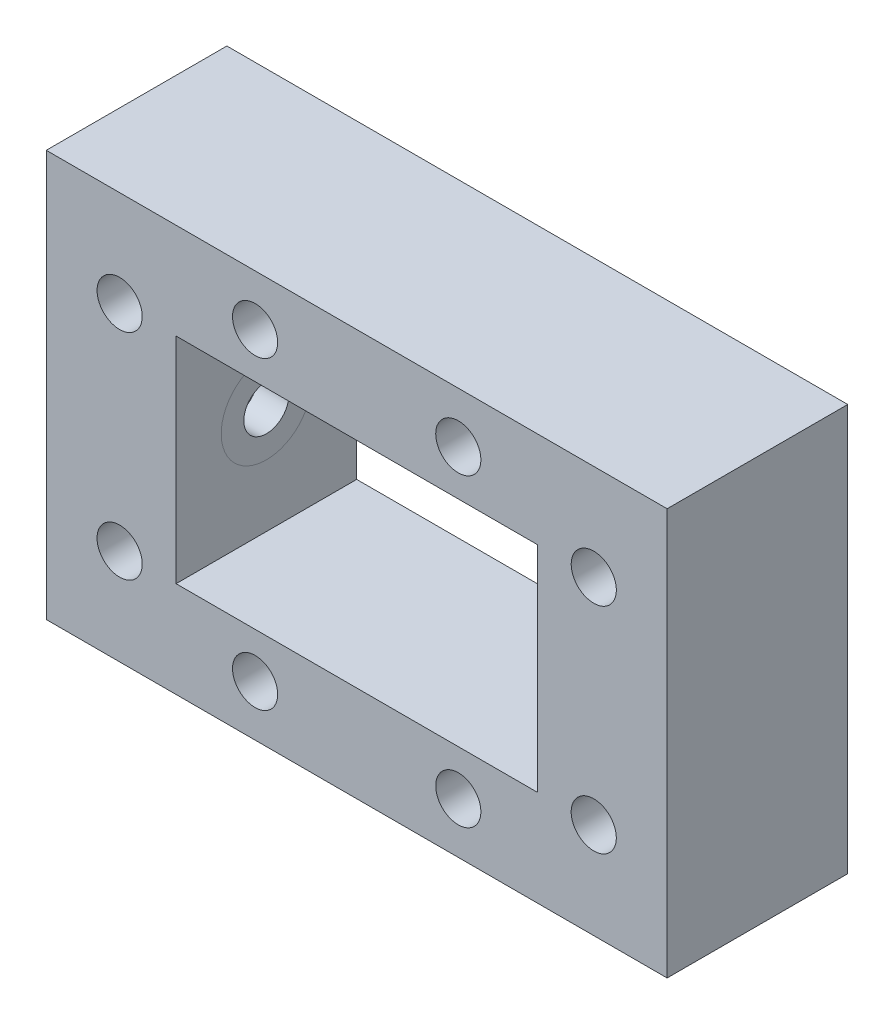
from build123d import *

# Parameters (mm, degrees)
SKETCH1_W           = 55
SKETCH1_H           = 36
SKETCH1_R           = 2
SKETCH1_W_2         = 32
SKETCH1_H_2         = 19
BOSS_EXTRUDE1_DEPTH = 8
SKETCH2_R           = 2
CUT_EXTRUDE1_DEPTH  = 7
SKETCH3_R           = 4
CUT_EXTRUDE2_DEPTH  = 48.75196331
SKETCH3_5_R         = 4
SKETCH3_5_R_2       = 2
BOSS_EXTRUDE2_DEPTH = 4.5


with BuildPart() as part:
    # Sketch1 → Boss-Extrude1 (new, symmetric)
    with BuildSketch(Plane.XY):
        Rectangle(SKETCH1_W, SKETCH1_H)
        with Locations((-21, 9.5)):
            Circle(SKETCH1_R, mode=Mode.SUBTRACT)
        with Locations((-9, 13.5)):
            Circle(SKETCH1_R, mode=Mode.SUBTRACT)
        with Locations((-21, -9.5)):
            Circle(SKETCH1_R, mode=Mode.SUBTRACT)
        with Locations((-9, -13.5)):
            Circle(SKETCH1_R, mode=Mode.SUBTRACT)
        with Locations((9, -13.5)):
            Circle(SKETCH1_R, mode=Mode.SUBTRACT)
        with Locations((21, -9.5)):
            Circle(SKETCH1_R, mode=Mode.SUBTRACT)
        with Locations((9, 13.5)):
            Circle(SKETCH1_R, mode=Mode.SUBTRACT)
        with Locations((21, 9.5)):
            Circle(SKETCH1_R, mode=Mode.SUBTRACT)
        Rectangle(SKETCH1_W_2, SKETCH1_H_2, mode=Mode.SUBTRACT)
    extrude(amount=BOSS_EXTRUDE1_DEPTH, both=True)

    # Sketch2 → Cut-Extrude1 (cut)
    with BuildSketch(Plane.XZ.offset(18)):
        with Locations((-15, 0)):
            Circle(SKETCH2_R)
        with Locations((15, 0)):
            Circle(SKETCH2_R)
    extrude(amount=-CUT_EXTRUDE1_DEPTH, mode=Mode.SUBTRACT)

    # Sketch3 → Cut-Extrude2 (cut, through all)
    with BuildSketch(Plane(origin=(-16, 0, 0), x_dir=(0, 0, -1), z_dir=(1, 0, 0))):
        Circle(SKETCH3_R)
    extrude(amount=-CUT_EXTRUDE2_DEPTH, mode=Mode.SUBTRACT)


with BuildPart() as body_2:
    # Sketch3<5> → Boss-Extrude2 (new body)
    with BuildSketch(Plane(origin=(-16, 0, 0), x_dir=(0, 0, -1), z_dir=(1, 0, 0))):
        Circle(SKETCH3_5_R)
        Circle(SKETCH3_5_R_2, mode=Mode.SUBTRACT)
    extrude(amount=-BOSS_EXTRUDE2_DEPTH)


with BuildPart() as cut_revolve1_tool:
    # Sketch4 → Cut-Revolve1 (revolve)
    with BuildSketch(Plane.XY):
        Polygon((-27.5, 0), (-27.5, 5), (-20.5, 5), (-17.613248654, 0), align=None)
    revolve(axis=Axis((0, 0, 0), (-1, 0, 0)))


with BuildPart() as part_1:
    add(part.part)

    # Cut-Revolve1: cut by cut_revolve1_tool
    add(cut_revolve1_tool.part, mode=Mode.SUBTRACT)


with BuildPart() as body_2_1:
    add(body_2.part)

    # Cut-Revolve1: cut by cut_revolve1_tool
    add(cut_revolve1_tool.part, mode=Mode.SUBTRACT)


solid = Compound([part_1.part, body_2_1.part])
